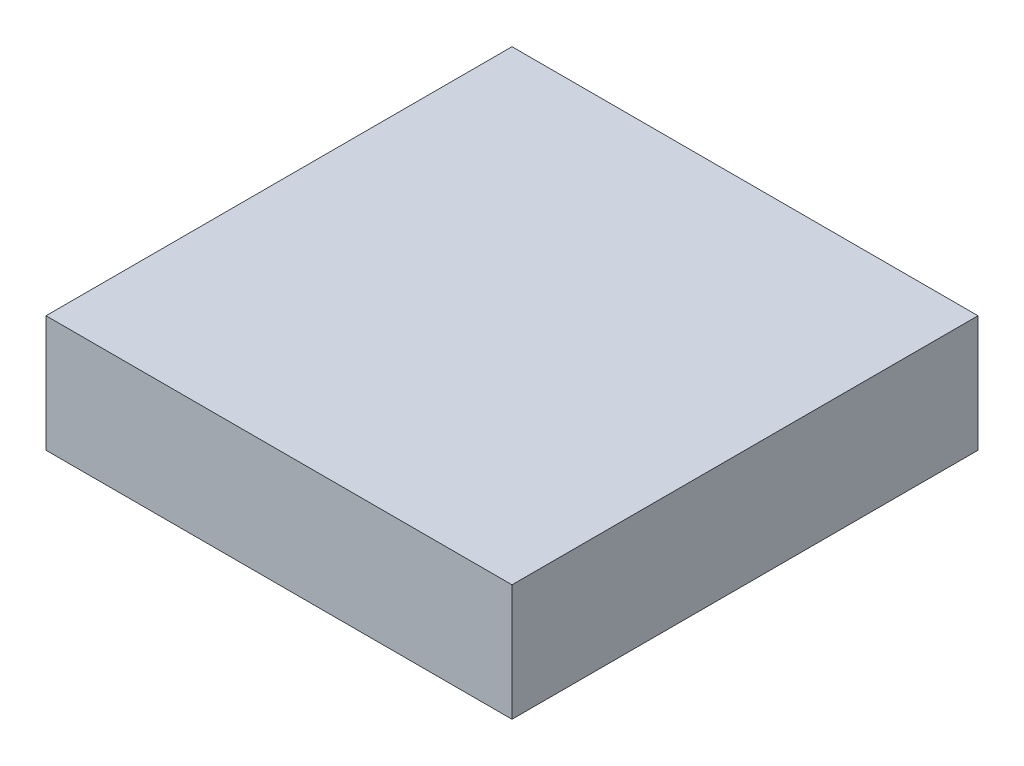
from build123d import *

# Parameters (mm, degrees)
CROQUIS1_W              = 40
CROQUIS1_H              = 40
SALIENTE_EXTRUIR1_DEPTH = 10


with BuildPart() as part:
    # Croquis1 → Saliente-Extruir1 (new body)
    with BuildSketch(Plane(origin=(0, 0, 0), x_dir=(1, 0, 0), z_dir=(0, 1, 0))):
        with Locations((20, 20)):
            Rectangle(CROQUIS1_W, CROQUIS1_H)
    extrude(amount=SALIENTE_EXTRUIR1_DEPTH)


solid = part.part
